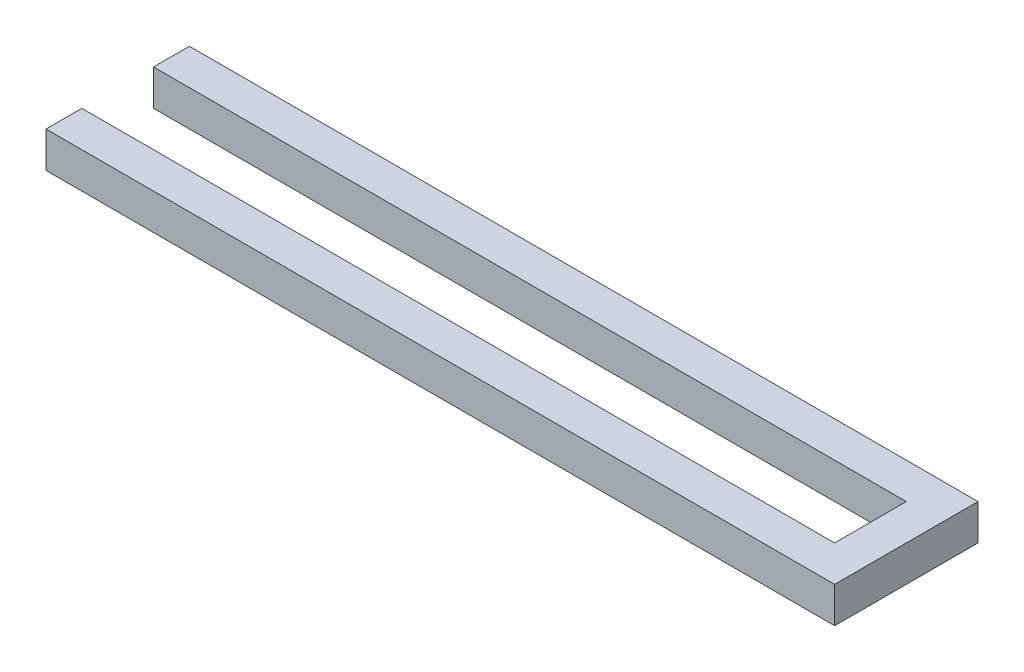
from build123d import *

# Parameters (mm, degrees)
SKETCH1_W           = 210
SKETCH1_H           = 10
BOSS_EXTRUDE1_DEPTH = 10


with BuildPart() as part:
    # Sketch1 → Boss-Extrude1 (new body)
    with BuildSketch(Plane(origin=(0, 0, 0), x_dir=(1, 0, 0), z_dir=(0, 1, 0))):
        with Locations((77.998094374, -14.015426497)):
            Rectangle(SKETCH1_W, SKETCH1_H)
        Polygon((192.998094374, 20.984573503), (182.998094374, 20.984573503), (182.998094374, 10.984573503), (182.998094374, -9.015426497), (182.998094374, -19.015426497), (192.998094374, -19.015426497), align=None)
        with Locations((77.998094374, 15.984573503)):
            Rectangle(SKETCH1_W, SKETCH1_H)
    extrude(amount=BOSS_EXTRUDE1_DEPTH)


solid = part.part
